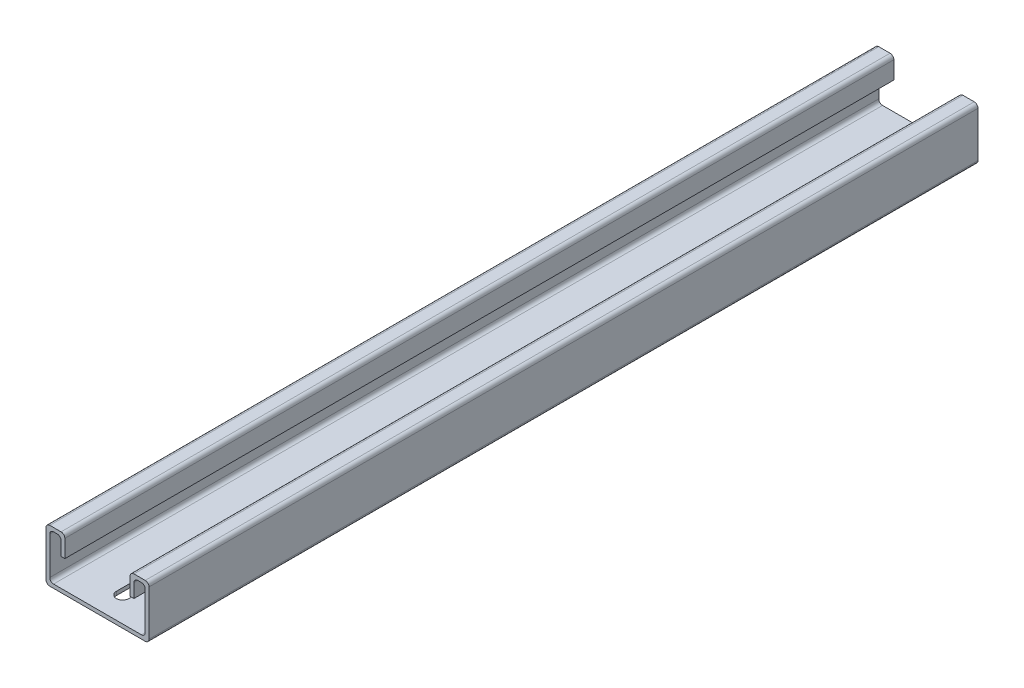
from build123d import *

# Parameters (mm, degrees)
EXTRUDE_1_DEPTH     = 330
CUT_EXTRUDE_1_DEPTH = 331.802811354


with BuildPart() as part:
    # 草图1 → 凸台-拉伸1 (new body)
    with BuildSketch(Plane.XY):
        with BuildLine():
            Line((-19, 10.5), (-14.5, 10.5))
            ThreePointArc((-14.5, 10.5), (-13.439339828, 10.060660172), (-13, 9))
            Line((-13, 9), (-13, 2))
            Line((-13, 2), (-14.5, 2))
            Line((-14.5, 2), (-14.5, 7.5))
            ThreePointArc((-14.5, 7.5), (-14.939339828, 8.560660172), (-16, 9))
            Line((-16, 9), (-17.5, 9))
            ThreePointArc((-17.5, 9), (-18.560660172, 8.560660172), (-19, 7.5))
            Line((-19, 7.5), (-19, -7.5))
            ThreePointArc((-19, -7.5), (-18.560660172, -8.560660172), (-17.5, -9))
            Line((-17.5, -9), (17.5, -9))
            ThreePointArc((17.5, -9), (18.560660172, -8.560660172), (19, -7.5))
            Line((19, -7.5), (19, 7.5))
            ThreePointArc((19, 7.5), (18.560660172, 8.560660172), (17.5, 9))
            Line((17.5, 9), (16, 9))
            ThreePointArc((16, 9), (14.939339828, 8.560660172), (14.5, 7.5))
            Line((14.5, 7.5), (14.5, 2))
            Line((14.5, 2), (13, 2))
            Line((13, 2), (13, 9))
            ThreePointArc((13, 9), (13.439339828, 10.060660172), (14.5, 10.5))
            Line((14.5, 10.5), (19, 10.5))
            ThreePointArc((19, 10.5), (20.060660172, 10.060660172), (20.5, 9))
            Line((20.5, 9), (20.5, -9))
            ThreePointArc((20.5, -9), (20.060660172, -10.060660172), (19, -10.5))
            Line((19, -10.5), (-19, -10.5))
            ThreePointArc((-19, -10.5), (-20.060660172, -10.060660172), (-20.5, -9))
            Line((-20.5, -9), (-20.5, 9))
            ThreePointArc((-20.5, 9), (-20.060660172, 10.060660172), (-19, 10.5))
        make_face()
    extrude(amount=EXTRUDE_1_DEPTH)

    # 草图3 → 切除-拉伸1 (cut, through all)
    with BuildSketch(Plane(origin=(0, 0, 0), x_dir=(1, 0, 0), z_dir=(0, 1, 0))):
        with BuildLine():
            Line((2.5, -10), (2.5, -30))
            ThreePointArc((2.5, -30), (0, -32.5), (-2.5, -30))
            Line((-2.5, -30), (-2.5, -10))
            ThreePointArc((-2.5, -10), (0, -7.5), (2.5, -10))
        make_face()
        with BuildLine():
            Line((2.5, -45), (2.5, -65))
            ThreePointArc((2.5, -65), (0, -67.5), (-2.5, -65))
            Line((-2.5, -65), (-2.5, -45))
            ThreePointArc((-2.5, -45), (0, -42.5), (2.5, -45))
        make_face()
        with BuildLine():
            Line((2.5, -155), (2.5, -175))
            ThreePointArc((2.5, -175), (0, -177.5), (-2.5, -175))
            Line((-2.5, -175), (-2.5, -155))
            ThreePointArc((-2.5, -155), (0, -152.5), (2.5, -155))
        make_face()
        with BuildLine():
            Line((-2.5, -320), (-2.5, -300))
            ThreePointArc((-2.5, -300), (0, -297.5), (2.5, -300))
            Line((2.5, -300), (2.5, -320))
            ThreePointArc((2.5, -320), (0, -322.5), (-2.5, -320))
        make_face()
        with BuildLine():
            Line((-2.5, -285), (-2.5, -265))
            ThreePointArc((-2.5, -265), (0, -262.5), (2.5, -265))
            Line((2.5, -265), (2.5, -285))
            ThreePointArc((2.5, -285), (0, -287.5), (-2.5, -285))
        make_face()
    extrude(amount=-CUT_EXTRUDE_1_DEPTH, mode=Mode.SUBTRACT)


solid = part.part
